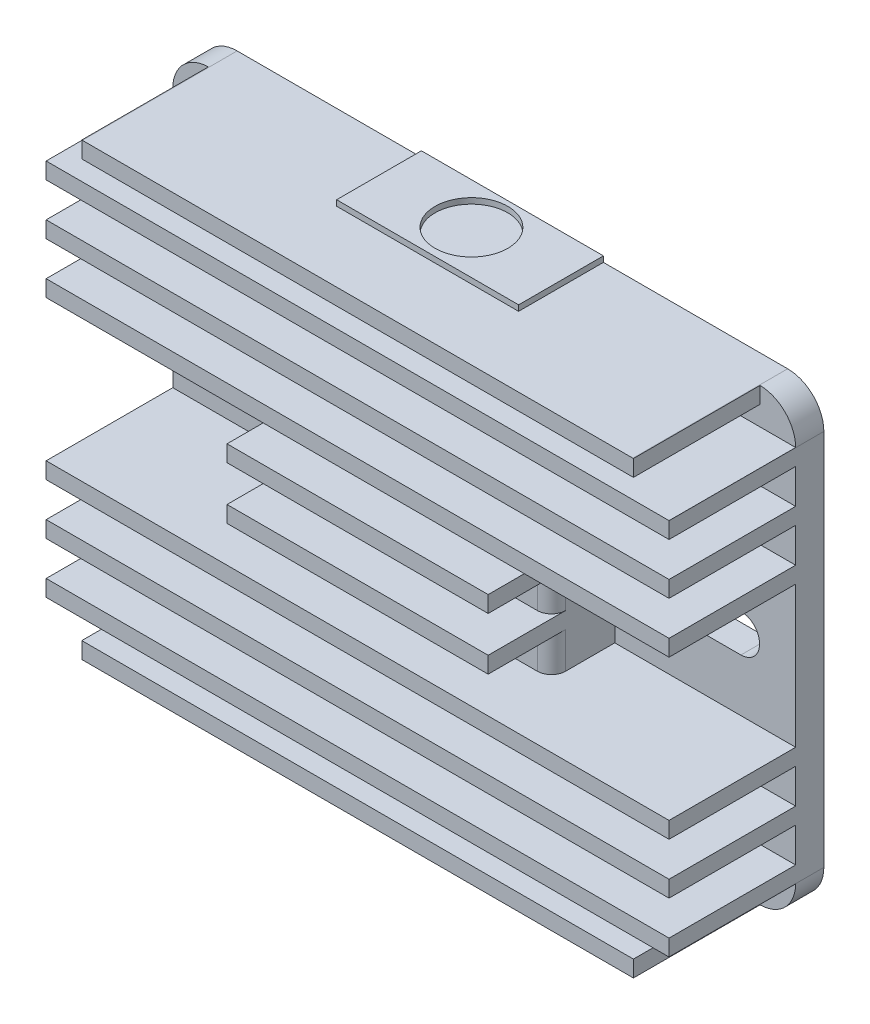
from build123d import *

# Parameters (mm, degrees)
SKETCH_1_W          = 110.2
SKETCH_1_H          = 79.6
EXTRUDE_1_DEPTH     = 4.99
SKETCH_2_W          = 52.2
SKETCH_2_H          = 6.4
EXTRUDE_2_DEPTH     = 15
SKETCH_3_W          = 46.2
SKETCH_3_H          = 73.2
EXTRUDE_3_DEPTH     = 11.2
SKETCH_4_W          = 97.6
SKETCH_4_H          = 2.9
SKETCH_4_W_2        = 46.2
SKETCH_4_W_3        = 110.2
EXTRUDE_4_DEPTH     = 22.4
SKETCH_5_W          = 17.339600334
SKETCH_5_H          = 6.7
CUT_EXTRUDE_1_DEPTH = 138.775034023
FILLET_1_R          = 3.3
FILLET_2_R          = 6.4
FILLET_3_R          = 2.5
SKETCH_6_W          = 32.2
SKETCH_6_H          = 15
EXTRUDE_5_DEPTH     = 1
SKETCH_7_R          = 6.438822501
CUT_EXTRUDE_2_DEPTH = 1


with BuildPart() as part:
    # ｽｹｯﾁ1 → ﾎﾞｽ - 押し出し1 (new body)
    with BuildSketch(Plane.XY):
        with Locations((55.1, 39.8)):
            Rectangle(SKETCH_1_W, SKETCH_1_H)
    extrude(amount=EXTRUDE_1_DEPTH)

    # ｽｹｯﾁ2 → ﾎﾞｽ - 押し出し2 (add)
    with BuildSketch(Plane.XY.offset(4.99)):
        with Locations((55.1, 76.4)):
            Rectangle(SKETCH_2_W, SKETCH_2_H)
    extrude(amount=EXTRUDE_2_DEPTH)

    # ｽｹｯﾁ3 → ﾎﾞｽ - 押し出し3 (add)
    with BuildSketch(Plane.XY.offset(4.99)):
        with Locations((55.1, 36.6)):
            Rectangle(SKETCH_3_W, SKETCH_3_H)
    extrude(amount=EXTRUDE_3_DEPTH)

    # ｽｹｯﾁ4 → ﾎﾞｽ - 押し出し4 (add)
    with BuildSketch(Plane.XY.offset(4.99)):
        with Locations((55.1, 78.15)):
            Rectangle(SKETCH_4_W, SKETCH_4_H)
        with Locations((55.1, 1.45)):
            Rectangle(SKETCH_4_W, SKETCH_4_H)
        with Locations((55.1, 44.45)):
            Rectangle(SKETCH_4_W_2, SKETCH_4_H)
        with Locations((55.1, 35.15)):
            Rectangle(SKETCH_4_W_2, SKETCH_4_H)
        with Locations((55.1, 53.75)):
            Rectangle(SKETCH_4_W_3, SKETCH_4_H)
        with Locations((55.1, 25.85)):
            Rectangle(SKETCH_4_W_3, SKETCH_4_H)
        with Locations((55.1, 71.781871857)):
            Rectangle(SKETCH_4_W_3, SKETCH_4_H)
        with Locations((55.1, 7.818128143)):
            Rectangle(SKETCH_4_W_3, SKETCH_4_H)
        with Locations((55.1, 16.834064072)):
            Rectangle(SKETCH_4_W_3, SKETCH_4_H)
        with Locations((55.1, 62.765935928)):
            Rectangle(SKETCH_4_W_3, SKETCH_4_H)
    extrude(amount=EXTRUDE_4_DEPTH)

    # ｽｹｯﾁ5 → ｶｯﾄ - 押し出し1 (cut, through all)
    with BuildSketch(Plane.XY.offset(4.99)):
        with Locations((15.05636048, 39.95)):
            Rectangle(SKETCH_5_W, SKETCH_5_H)
        with Locations((95.14363952, 39.95)):
            Rectangle(SKETCH_5_W, SKETCH_5_H)
    extrude(amount=-CUT_EXTRUDE_1_DEPTH, mode=Mode.SUBTRACT)

    # ﾌｨﾚｯﾄ1
    fillet_1_edges = [part.edges().sort_by_distance(p)[0] for p in [
        (6.386560313, 36.6, 2.495),
        (6.386560313, 43.3, 2.495),
        (23.726160647, 43.3, 2.495),
        (23.726160647, 36.6, 2.495),
        (86.473839353, 43.3, 2.495),
        (103.813439687, 43.3, 2.495),
        (103.813439687, 36.6, 2.495),
        (86.473839353, 36.6, 2.495),
    ]]
    fillet(fillet_1_edges, radius=FILLET_1_R)

    # ﾌｨﾚｯﾄ2
    fillet_2_edges = [part.edges().sort_by_distance(p)[0] for p in [
        (0, 0, 2.495),
        (110.2, 0, 2.495),
        (110.2, 79.6, 2.495),
        (0, 79.6, 2.495),
    ]]
    fillet(fillet_2_edges, radius=FILLET_2_R)

    # ﾌｨﾚｯﾄ3
    fillet_3_edges = [part.edges().sort_by_distance(p)[0] for p in [
        (78.2, 49.1, 16.19),
        (32, 39.8, 16.19),
        (78.2, 58.257967964, 16.19),
        (32, 49.1, 16.19),
        (78.2, 30.5, 16.19),
        (32, 21.342032036, 16.19),
        (81.2, 74.965935928, 19.99),
        (32, 67.273903893, 16.19),
        (78.2, 12.326096107, 16.19),
        (32, 4.634064072, 16.19),
        (32, 12.326096107, 16.19),
        (78.2, 21.342032036, 16.19),
        (78.2, 67.273903893, 16.19),
        (32, 58.257967964, 16.19),
        (29, 74.965935928, 19.99),
        (78.2, 4.634064072, 16.19),
        (32, 30.5, 16.19),
        (78.2, 39.8, 16.19),
    ]]
    fillet(fillet_3_edges, radius=FILLET_3_R)

    # ｽｹｯﾁ6 → ﾎﾞｽ - 押し出し5 (add)
    with BuildSketch(Plane(origin=(0, 79.6, 0), x_dir=(1, 0, 0), z_dir=(0, 1, 0))):
        with Locations((55.1, -7.5)):
            Rectangle(SKETCH_6_W, SKETCH_6_H)
    extrude(amount=EXTRUDE_5_DEPTH)

    # ｽｹｯﾁ7 → ｶｯﾄ - 押し出し2 (cut)
    with BuildSketch(Plane(origin=(0, 80.6, 0), x_dir=(1, 0, 0), z_dir=(0, 1, 0))):
        with Locations(Location((55.154186251, -7.301022377, 0), (0, 0, 270))):
            Circle(SKETCH_7_R)
    extrude(amount=-CUT_EXTRUDE_2_DEPTH, mode=Mode.SUBTRACT)


solid = part.part
